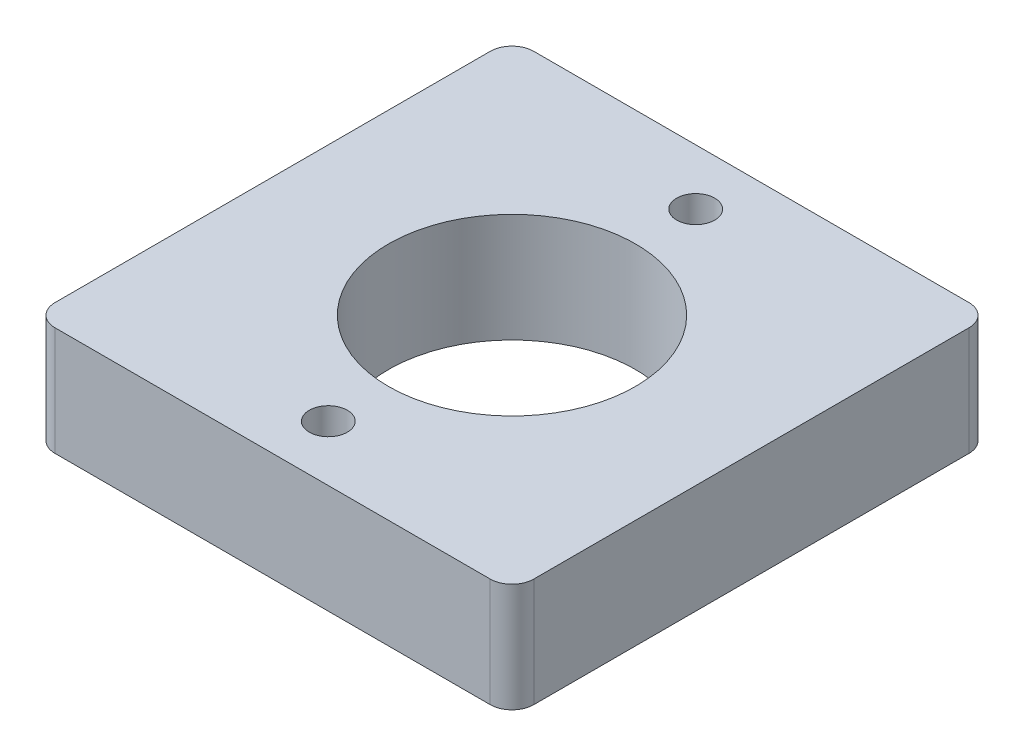
from build123d import *

# Parameters (mm, degrees)
CROQUIS1_W              = 44
CROQUIS1_H              = 44
CROQUIS1_R              = 11.35
SALIENTE_EXTRUIR1_DEPTH = 10
CROQUIS2_R              = 1.75
CORTAR_EXTRUIR1_DEPTH   = 33.680269277
REDONDEO1_R             = 2


with BuildPart() as part:
    # Croquis1 → Saliente-Extruir1 (new body)
    with BuildSketch(Plane(origin=(0, 0, 0), x_dir=(1, 0, 0), z_dir=(0, 1, 0))):
        Rectangle(CROQUIS1_W, CROQUIS1_H)
        with Locations(Location((0, 0, 0), (0, 0, 270))):
            Circle(CROQUIS1_R, mode=Mode.SUBTRACT)
    extrude(amount=SALIENTE_EXTRUIR1_DEPTH)

    # Croquis2 → Cortar-Extruir1 (cut, through all)
    with BuildSketch(Plane(origin=(0, 10, 0), x_dir=(1, 0, 0), z_dir=(0, 1, 0))):
        with Locations(Location((0, 16.88, 0), (0, 0, 270))):
            Circle(CROQUIS2_R)
        with Locations(Location((0, -16.88, 0), (0, 0, 270))):
            Circle(CROQUIS2_R)
    extrude(amount=-CORTAR_EXTRUIR1_DEPTH, mode=Mode.SUBTRACT)

    # Redondeo1
    redondeo1_edges = [part.edges().sort_by_distance(p)[0] for p in [
        (22, 5, 22),
        (-22, 5, 22),
        (-22, 5, -22),
        (22, 5, -22),
    ]]
    fillet(redondeo1_edges, radius=REDONDEO1_R)


solid = part.part
